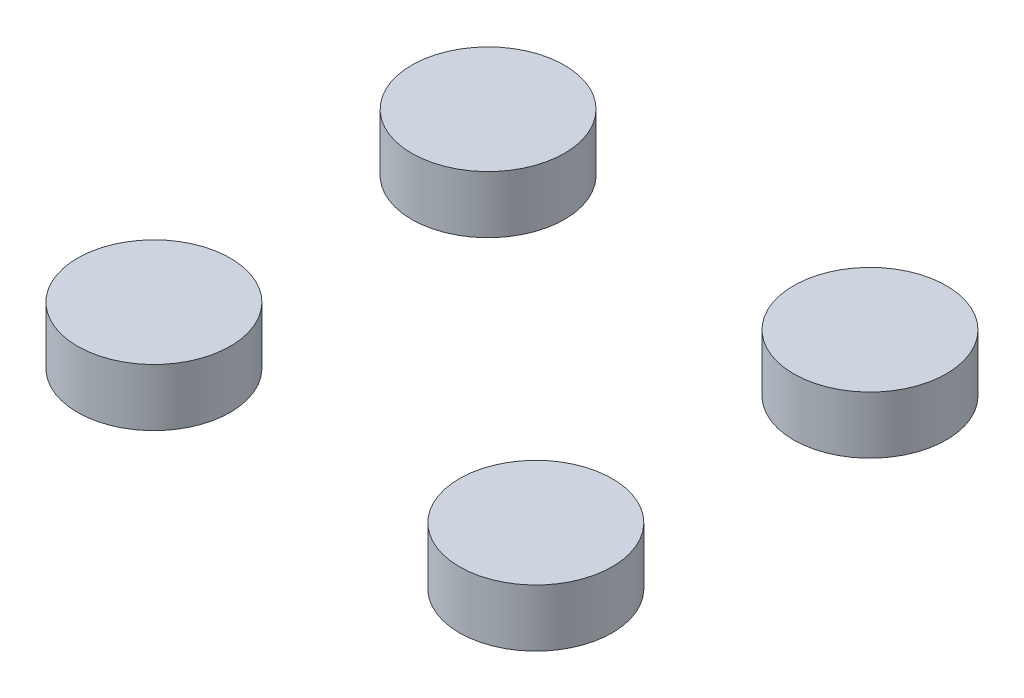
from build123d import *

# Parameters (mm, degrees)
BOSS_EXTRUDE1_START = 1440
SKETCH1_R           = 160
BOSS_EXTRUDE1_DEPTH = 120
BOSS_EXTRUDE2_START = 1440
SKETCH2_R           = 160
BOSS_EXTRUDE2_DEPTH = 120
BOSS_EXTRUDE3_START = 1440
SKETCH3_R           = 160
BOSS_EXTRUDE3_DEPTH = 120
BOSS_EXTRUDE4_START = 1440
SKETCH4_R           = 160
BOSS_EXTRUDE4_DEPTH = 120


with BuildPart() as part:
    # Sketch1 → Boss-Extrude1 (new body)
    with BuildSketch(Plane(origin=(0, 0, 0), x_dir=(1, 0, 0), z_dir=(0, 1, 0)).offset(BOSS_EXTRUDE1_START)):
        with Locations(Location((-400, 350, 0), (0, 0, 270))):
            Circle(SKETCH1_R)
    extrude(amount=BOSS_EXTRUDE1_DEPTH)


with BuildPart() as body_2:
    # Sketch2 → Boss-Extrude2 (new body)
    with BuildSketch(Plane(origin=(0, 0, 0), x_dir=(1, 0, 0), z_dir=(0, 1, 0)).offset(BOSS_EXTRUDE2_START)):
        with Locations(Location((-400, -350, 0), (0, 0, 270))):
            Circle(SKETCH2_R)
    extrude(amount=BOSS_EXTRUDE2_DEPTH)


with BuildPart() as body_3:
    # Sketch3 → Boss-Extrude3 (new body)
    with BuildSketch(Plane(origin=(0, 0, 0), x_dir=(1, 0, 0), z_dir=(0, 1, 0)).offset(BOSS_EXTRUDE3_START)):
        with Locations(Location((400, 350, 0), (0, 0, 270))):
            Circle(SKETCH3_R)
    extrude(amount=BOSS_EXTRUDE3_DEPTH)


with BuildPart() as body_4:
    # Sketch4 → Boss-Extrude4 (new body)
    with BuildSketch(Plane(origin=(0, 0, 0), x_dir=(1, 0, 0), z_dir=(0, 1, 0)).offset(BOSS_EXTRUDE4_START)):
        with Locations(Location((400, -350, 0), (0, 0, 270))):
            Circle(SKETCH4_R)
    extrude(amount=BOSS_EXTRUDE4_DEPTH)


solid = Compound([part.part, body_2.part, body_3.part, body_4.part])
